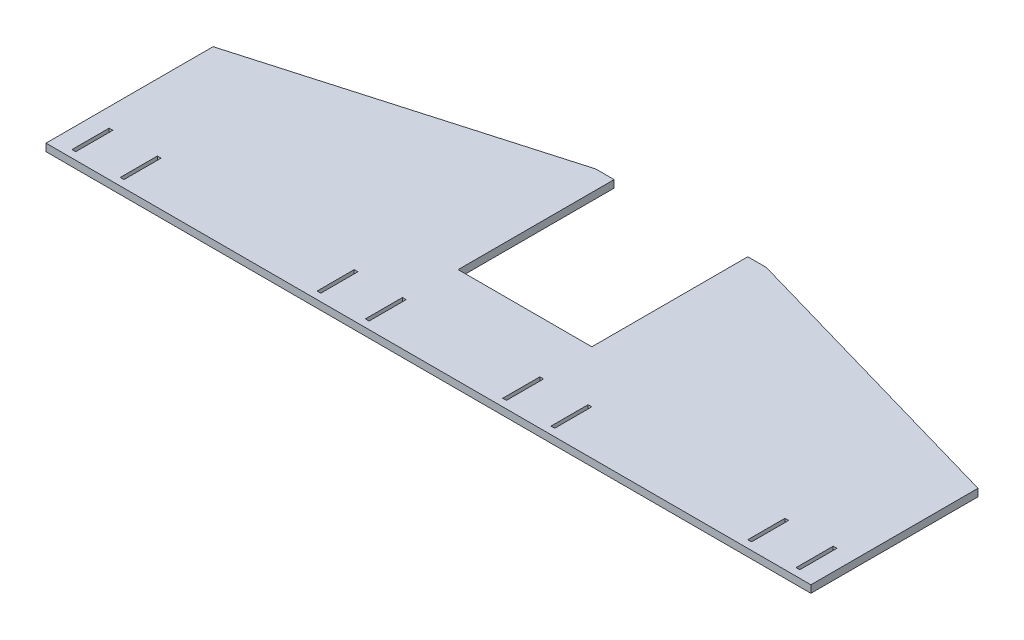
from build123d import *

# Parameters (mm, degrees)
BOSS_EXTRUDE1_DEPTH = 2
SKETCH4_W           = 1
SKETCH4_H           = 10
CUT_EXTRUDE1_DEPTH  = 124.438243669


with BuildPart() as part:
    # Sketch3 → Boss-Extrude1 (new body)
    with BuildSketch(Plane(origin=(0, 0, 0), x_dir=(1, 0, 0), z_dir=(0, 1, 0))):
        Polygon((-103, 0), (-103, 45), (-23, 68), (-18, 68), (-18, 26), (18, 26), (18, 68), (23, 68), (103, 45), (103, 0), align=None)
    extrude(amount=BOSS_EXTRUDE1_DEPTH)

    # Sketch4 → Cut-Extrude1 (cut, through all)
    with BuildSketch(Plane(origin=(0, 2, 0), x_dir=(1, 0, 0), z_dir=(0, 1, 0))):
        with Locations((-97.5, 7)):
            Rectangle(SKETCH4_W, SKETCH4_H)
        with Locations((-84.5, 7)):
            Rectangle(SKETCH4_W, SKETCH4_H)
        with Locations((-31.5, 7)):
            Rectangle(SKETCH4_W, SKETCH4_H)
        with Locations((-18.5, 7)):
            Rectangle(SKETCH4_W, SKETCH4_H)
    cut_extrude1 = extrude(amount=-CUT_EXTRUDE1_DEPTH, mode=Mode.SUBTRACT)

    # Mirror1: Cut-Extrude1 across plane
    add(cut_extrude1.mirror(Plane.ZY), mode=Mode.SUBTRACT)


solid = part.part
